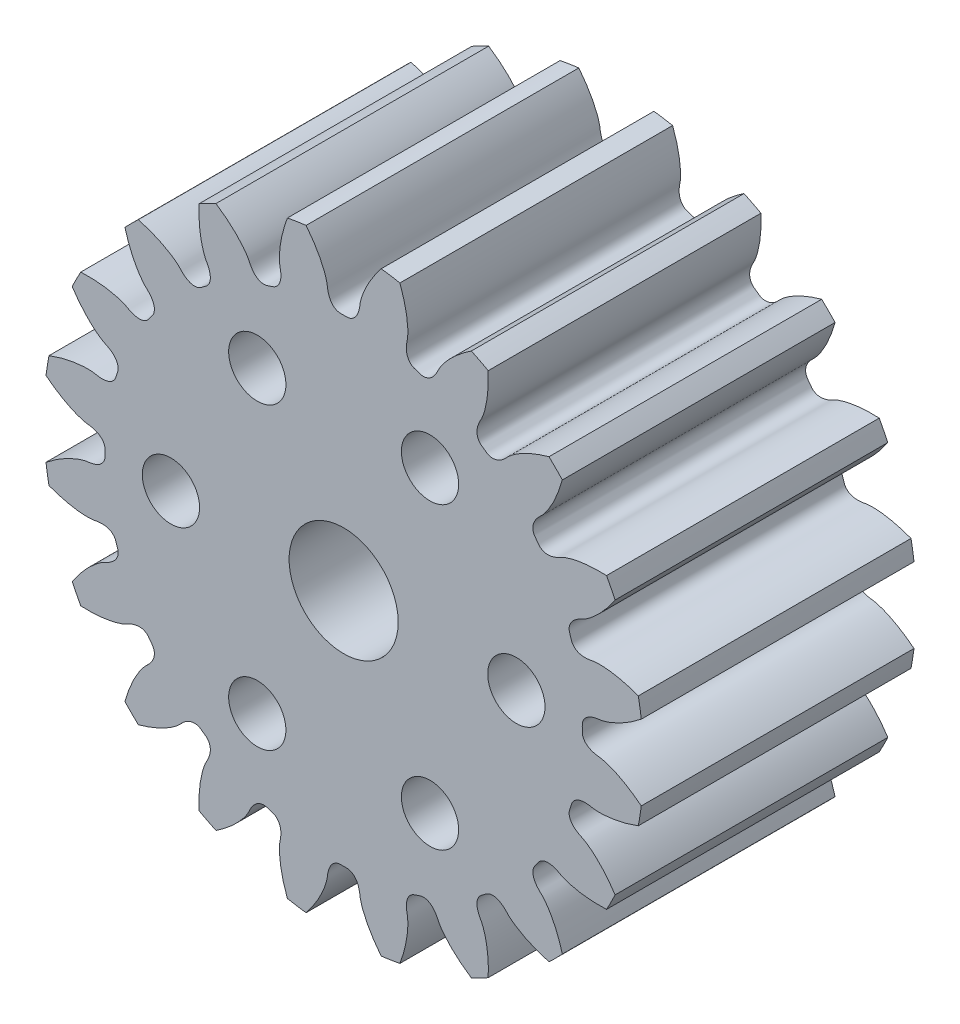
from build123d import *

# Parameters (mm, degrees)
SKETCHREVOLVESPURPINION_W       = 15
SKETCHREVOLVESPURPINION_H       = 16.499999752
TOOTHEXTRUDECUTSPURPINION_DEPTH = 7.5
PATTERNSPURPINION_COUNT         = 20
BOREREVOLVESKETCH_W             = 15
BOREREVOLVESKETCH_H             = 6.349999905
SKETCH6_R                       = 6.349999905
BOSS_EXTRUDE1_DEPTH             = 15
SKETCH7_R                       = 1.575
CUT_EXTRUDE2_DEPTH              = 15
SKETCH10_R                      = 3
CUT_EXTRUDE3_DEPTH              = 28.585678957


with BuildPart() as part:
    # SketchRevolveSpurPinion → SpurPinion (revolve)
    with BuildSketch(Plane(origin=(0, 0, 0), x_dir=(0, 0, -1), z_dir=(1, 0, 0))):
        with Locations((0, 8.249999876)):
            Rectangle(SKETCHREVOLVESPURPINION_W, SKETCHREVOLVESPURPINION_H)
    revolve(axis=Axis((0, 0, 0), (0, 0, -1)))

    # SketchToothSpurPinion → ToothExtrudeCutSpurPinion (cut, symmetric)
    with BuildSketch(Plane.XY):
        with BuildLine():
            ThreePointArc((16.438815928, 2.120364973), (16.574999751, 0), (16.438815928, -2.120364973))
            add(Edge.make_bspline(
                [(16.438815928, -2.120364973), (16.306213447, -2.012632117), (16.10792267, -1.860929635), (15.841705586, -1.676668952), (15.654853966, -1.55570694), (15.475899367, -1.447553762), (15.305444286, -1.351598726), (15.144060802, -1.267206192), (14.992289617, -1.193717229), (14.850639169, -1.130450845), (14.719584801, -1.076705465), (14.599567989, -1.031760051), (14.490995569, -0.994876416), (14.394239239, -0.965297926), (14.309634406, -0.942259481), (14.237481255, -0.924963555), (14.178039549, -0.912655545), (14.086834677, -0.896506904), (14.00050495, -0.889480557), (13.917115117, -0.875299465), (13.876251184, -0.867580325), (13.836207138, -0.859024104), (13.796954391, -0.849666504), (13.758470111, -0.839473161), (13.720726654, -0.828419822), (13.683694388, -0.816469789), (13.647341194, -0.80357799), (13.611633081, -0.789687732), (13.576534897, -0.774729001), (13.542011551, -0.758615952), (13.508029885, -0.741244218), (13.474561449, -0.722487944), (13.441586533, -0.70219671), (13.409099857, -0.680192663), (13.377118414, -0.656268352), (13.345691952, -0.630186146), (13.314916474, -0.60168053), (13.284950769, -0.570465185), (13.256035156, -0.536247272), (13.228510349, -0.498751625), (13.202831991, -0.45775717), (13.179575196, -0.413145628), (13.159417054, -0.364959761), (13.143103693, -0.313457674), (13.131342204, -0.259162176), (13.125319608, -0.20694118), (13.122692001, -0.120338913), (13.126795583, 0), (13.122692001, 0.120338913), (13.125319608, 0.20694118), (13.131342204, 0.259162176), (13.143103693, 0.313457674), (13.159417054, 0.364959761), (13.179575196, 0.413145628), (13.202831991, 0.45775717), (13.228510349, 0.498751625), (13.256035156, 0.536247272), (13.284950769, 0.570465185), (13.314916474, 0.60168053), (13.345691952, 0.630186146), (13.377118414, 0.656268352), (13.409099857, 0.680192663), (13.441586533, 0.70219671), (13.474561449, 0.722487944), (13.508029885, 0.741244218), (13.542011551, 0.758615952), (13.576534897, 0.774729001), (13.611633081, 0.789687732), (13.647341194, 0.80357799), (13.683694388, 0.816469789), (13.720726654, 0.828419822), (13.758470111, 0.839473161), (13.796954391, 0.849666504), (13.836207138, 0.859024104), (13.876251184, 0.867580325), (13.917115117, 0.875299465), (14.00050495, 0.889480557), (14.086834677, 0.896506904), (14.178039549, 0.912655545), (14.237481255, 0.924963555), (14.309634406, 0.942259481), (14.394239239, 0.965297926), (14.490995569, 0.994876416), (14.599567989, 1.031760051), (14.719584801, 1.076705465), (14.850639169, 1.130450845), (14.992289617, 1.193717229), (15.144060802, 1.267206192), (15.305444286, 1.351598726), (15.475899367, 1.447553762), (15.654853966, 1.55570694), (15.841705586, 1.676668952), (16.10792267, 1.860929635), (16.306213447, 2.012632117), (16.438815928, 2.120364973)],
                knots=[0, 0, 0, 0, 0.061396832, 0.089671689, 0.11633084, 0.141374285, 0.164802023, 0.186614056, 0.206810382, 0.225391003, 0.242355917, 0.257705126, 0.271438628, 0.283556425, 0.294058515, 0.3029449, 0.310215578, 0.315870551, 0.33622093, 0.341282689, 0.346262417, 0.351165109, 0.355996353, 0.360762416, 0.365470336, 0.370128029, 0.374744413, 0.379329537, 0.383894732, 0.388452766, 0.393018008, 0.39760658, 0.402236496, 0.406927739, 0.411702255, 0.416583788, 0.421597487, 0.426769163, 0.432124081, 0.437685171, 0.443470588, 0.449490673, 0.455744615, 0.462217389, 0.468877827, 0.475678781, 0.481074813, 0.5, 0.518925187, 0.524321219, 0.531122173, 0.537782611, 0.544255385, 0.550509327, 0.556529412, 0.562314829, 0.567875919, 0.573230837, 0.578402513, 0.583416212, 0.588297745, 0.593072261, 0.597763504, 0.60239342, 0.606981992, 0.611547234, 0.616105268, 0.620670463, 0.625255587, 0.629871971, 0.634529664, 0.639237584, 0.644003647, 0.648834891, 0.653737583, 0.658717311, 0.66377907, 0.684129449, 0.689784422, 0.6970551, 0.705941485, 0.716443575, 0.728561372, 0.742294874, 0.757644083, 0.774608997, 0.793189618, 0.813385944, 0.835197977, 0.858625715, 0.88366916, 0.910328311, 0.938603168, 1, 1, 1, 1], degree=3))
        make_face()
    toothextrudecutspurpinion = extrude(amount=TOOTHEXTRUDECUTSPURPINION_DEPTH, both=True, mode=Mode.SUBTRACT)

    # PatternSpurPinion: ToothExtrudeCutSpurPinion ×20 about axis
    patternspurpinion_axis = Axis((0, 0, 55), (0, 0, -1))
    for i in range(1, PATTERNSPURPINION_COUNT):
        add(toothextrudecutspurpinion.rotate(patternspurpinion_axis, i * 360 / PATTERNSPURPINION_COUNT), mode=Mode.SUBTRACT)

    # BoreRevolveSketch → BoreRevolveCut (revolve, cut)
    with BuildSketch(Plane(origin=(0, 0, 0), x_dir=(0, 0, -1), z_dir=(1, 0, 0))):
        with Locations((0, 3.174999953)):
            Rectangle(BOREREVOLVESKETCH_W, BOREREVOLVESKETCH_H)
    revolve(axis=Axis((0, 0, 0), (0, 0, -1)), mode=Mode.SUBTRACT)

    # Sketch6 → Boss-Extrude1 (add)
    with BuildSketch(Plane.XY.offset(7.5)):
        Circle(SKETCH6_R)
    extrude(amount=-BOSS_EXTRUDE1_DEPTH)

    # Sketch7 → Cut-Extrude2 (cut)
    with BuildSketch(Plane.XY.offset(7.5)):
        with Locations((-9.5, 0)):
            Circle(SKETCH7_R)
        with Locations((-4.75, 8.227241336)):
            Circle(SKETCH7_R)
        with Locations((4.75, 8.227241336)):
            Circle(SKETCH7_R)
        with Locations((9.5, 0)):
            Circle(SKETCH7_R)
        with Locations((4.75, -8.227241336)):
            Circle(SKETCH7_R)
        with Locations((-4.75, -8.227241336)):
            Circle(SKETCH7_R)
    extrude(amount=-CUT_EXTRUDE2_DEPTH, mode=Mode.SUBTRACT)

    # Sketch10 → Cut-Extrude3 (cut, through all)
    with BuildSketch(Plane.XY.offset(7.5)):
        Circle(SKETCH10_R)
    extrude(amount=-CUT_EXTRUDE3_DEPTH, mode=Mode.SUBTRACT)


solid = part.part
